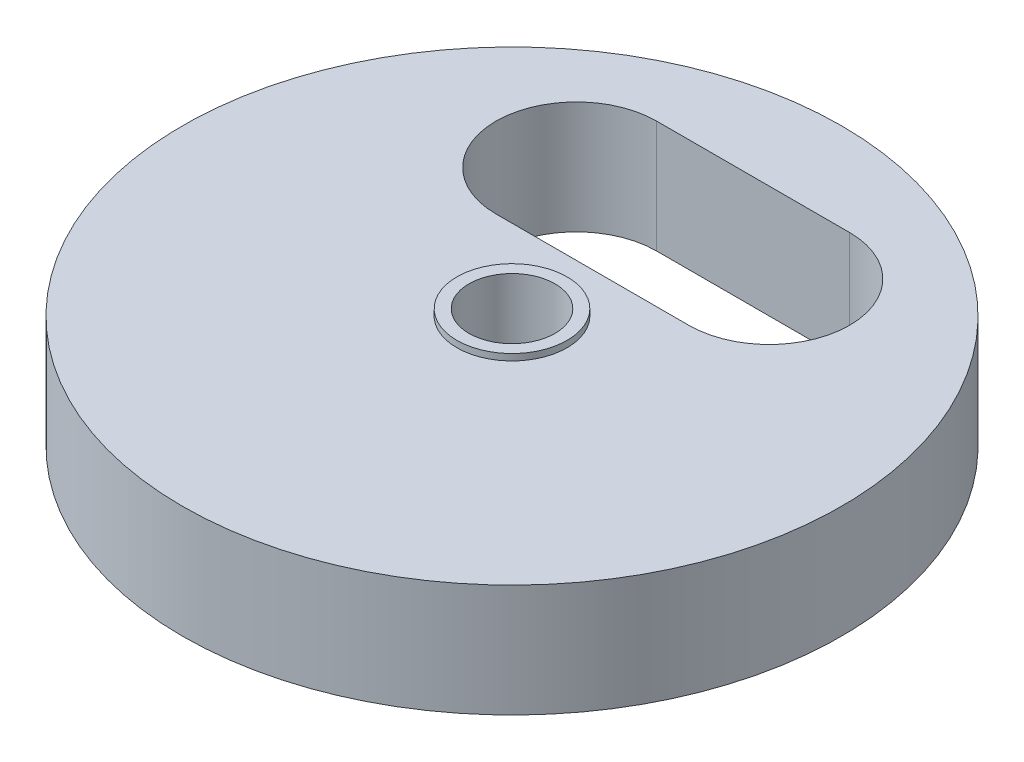
from build123d import *

# Parameters (mm, degrees)
SKETCH1_R           = 20.5
BOSS_EXTRUDE1_DEPTH = 7
SKETCH2_R           = 2.675
CUT_EXTRUDE1_DEPTH  = 7
BOSS_EXTRUDE2_START = 0.4
SKETCH3_R           = 3.425
SKETCH3_R_2         = 2.675
BOSS_EXTRUDE2_DEPTH = 0.4
CUT_EXTRUDE3_DEPTH  = 7


with BuildPart() as part:
    # Sketch1 → Boss-Extrude1 (new body)
    with BuildSketch(Plane(origin=(0, 0, 0), x_dir=(1, 0, 0), z_dir=(0, 1, 0))):
        with Locations(Location((0, 0, 0), (0, 0, 270))):
            Circle(SKETCH1_R)
    extrude(amount=BOSS_EXTRUDE1_DEPTH)

    # Sketch2 → Cut-Extrude1 (cut)
    with BuildSketch(Plane(origin=(0, 7, 0), x_dir=(1, 0, 0), z_dir=(0, 1, 0))):
        with Locations(Location((0, 0, 0), (0, 0, 270))):
            Circle(SKETCH2_R)
    extrude(amount=-CUT_EXTRUDE1_DEPTH, mode=Mode.SUBTRACT)

    # Sketch3 → Boss-Extrude2 (add)
    with BuildSketch(Plane(origin=(0, 7, 0), x_dir=(1, 0, 0), z_dir=(0, 1, 0)).offset(BOSS_EXTRUDE2_START)):
        with Locations(Location((0, 0, 0), (0, 0, 270))):
            Circle(SKETCH3_R)
        with Locations(Location((0, 0, 0), (0, 0, 270))):
            Circle(SKETCH3_R_2, mode=Mode.SUBTRACT)
    extrude(amount=-BOSS_EXTRUDE2_DEPTH)

    # Sketch5 → Cut-Extrude3 (cut)
    with BuildSketch(Plane(origin=(0, 7, 0), x_dir=(1, 0, 0), z_dir=(0, 1, 0))):
        with BuildLine():
            Line((-6, 15), (6, 15))
            ThreePointArc((6, 15), (11, 10), (6, 5))
            Line((6, 5), (-6, 5))
            ThreePointArc((-6, 5), (-11, 10), (-6, 15))
        make_face()
    extrude(amount=-CUT_EXTRUDE3_DEPTH, mode=Mode.SUBTRACT)


solid = part.part
